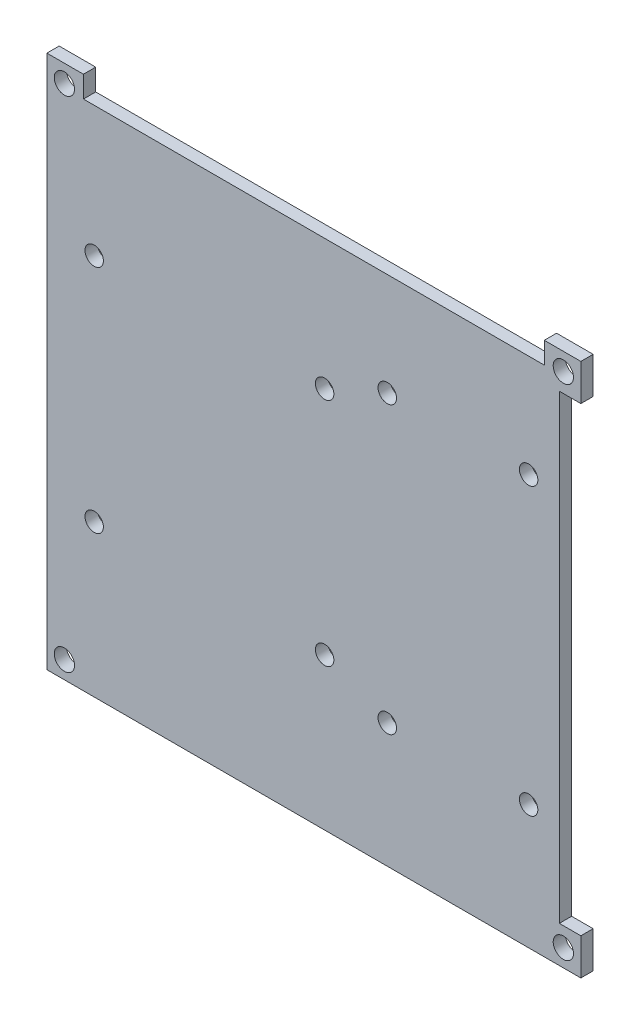
from build123d import *

# Parameters (mm, degrees)
SKETCH1_W           = 86.9
SKETCH1_H           = 86.9
BOSS_EXTRUDE1_DEPTH = 2
SKETCH2_R           = 1.65
CUT_EXTRUDE3_DEPTH  = 123.911431527
SKETCH3_R           = 1.5
CUT_EXTRUDE4_DEPTH  = 10
SKETCH4_R           = 1.5
CUT_EXTRUDE5_DEPTH  = 10
SKETCH5_W           = 3.5
SKETCH5_H           = 75
SKETCH5_W_2         = 75
SKETCH5_H_2         = 3.5
CUT_EXTRUDE6_DEPTH  = 123.911431527


with BuildPart() as part:
    # Sketch1 → Boss-Extrude1 (new body)
    with BuildSketch(Plane(origin=(0, 0, 0), x_dir=(0, 1, 0), z_dir=(0, 0, 1))):
        with Locations((43.45, 43.45)):
            Rectangle(SKETCH1_W, SKETCH1_H)
    extrude(amount=BOSS_EXTRUDE1_DEPTH)

    # Sketch2 → Cut-Extrude3 (cut, through all)
    with BuildSketch(Plane.XY.offset(2)):
        with Locations((-84.05, 2.85)):
            Circle(SKETCH2_R)
        with Locations((-2.85, 2.85)):
            Circle(SKETCH2_R)
        with Locations((-2.85, 84.05)):
            Circle(SKETCH2_R)
        with Locations((-84.05, 84.05)):
            Circle(SKETCH2_R)
    extrude(amount=-CUT_EXTRUDE3_DEPTH, mode=Mode.SUBTRACT)

    # Sketch3 → Cut-Extrude4 (cut)
    with BuildSketch(Plane.XY.offset(2)):
        with Locations((-79.2, 62.2)):
            Circle(SKETCH3_R)
        with Locations((-41.7, 62.2)):
            Circle(SKETCH3_R)
        with Locations((-41.7, 24.7)):
            Circle(SKETCH3_R)
        with Locations((-79.2, 24.7)):
            Circle(SKETCH3_R)
    extrude(amount=-CUT_EXTRUDE4_DEPTH, mode=Mode.SUBTRACT)

    # Sketch4 → Cut-Extrude5 (cut)
    with BuildSketch(Plane.XY.offset(2)):
        with Locations((-31.5, 66.7)):
            Circle(SKETCH4_R)
        with Locations((-8.5, 66.7)):
            Circle(SKETCH4_R)
        with Locations((-8.5, 20.2)):
            Circle(SKETCH4_R)
        with Locations((-31.5, 20.2)):
            Circle(SKETCH4_R)
    extrude(amount=-CUT_EXTRUDE5_DEPTH, mode=Mode.SUBTRACT)

    # Sketch5 → Cut-Extrude6 (cut, through all)
    with BuildSketch(Plane.XY.offset(2)):
        with Locations((-1.75, 43.45)):
            Rectangle(SKETCH5_W, SKETCH5_H)
        with Locations((-43.45, 85.15)):
            Rectangle(SKETCH5_W_2, SKETCH5_H_2)
    extrude(amount=-CUT_EXTRUDE6_DEPTH, mode=Mode.SUBTRACT)


solid = part.part
